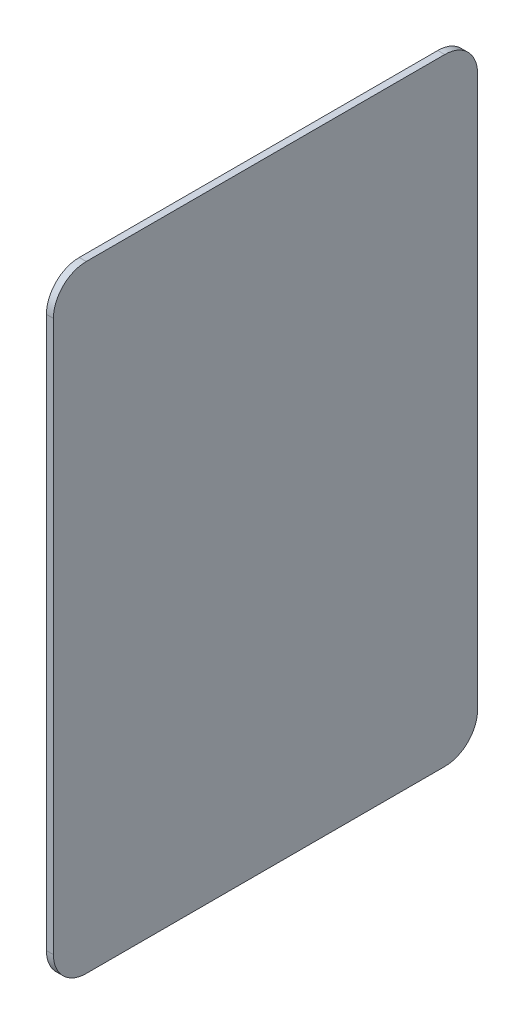
from build123d import *

# Parameters (mm, degrees)
BOSS_EXTRUDE1_DEPTH = 1.5875


with BuildPart() as part:
    # Sketch1 → Boss-Extrude1 (new body)
    with BuildSketch(Plane(origin=(0, 0, 0), x_dir=(0, 0, -1), z_dir=(1, 0, 0))):
        with BuildLine():
            Line((-81.948946946, 94.531421496), (-81.948946946, 219.626421496))
            ThreePointArc((-81.948946946, 219.626421496), (-84.131880106, 224.896488336), (-89.401946946, 227.079421496))
            Line((-89.401946946, 227.079421496), (-170.808946946, 227.079421496))
            ThreePointArc((-170.808946946, 227.079421496), (-176.079013786, 224.896488336), (-178.261946946, 219.626421496))
            Line((-178.261946946, 219.626421496), (-178.261946946, 94.531421496))
            ThreePointArc((-178.261946946, 94.531421496), (-176.079013786, 89.261354656), (-170.808946946, 87.078421496))
            Line((-170.808946946, 87.078421496), (-89.401946946, 87.078421496))
            ThreePointArc((-89.401946946, 87.078421496), (-84.131880106, 89.261354656), (-81.948946946, 94.531421496))
        make_face()
    extrude(amount=-BOSS_EXTRUDE1_DEPTH)


solid = part.part
